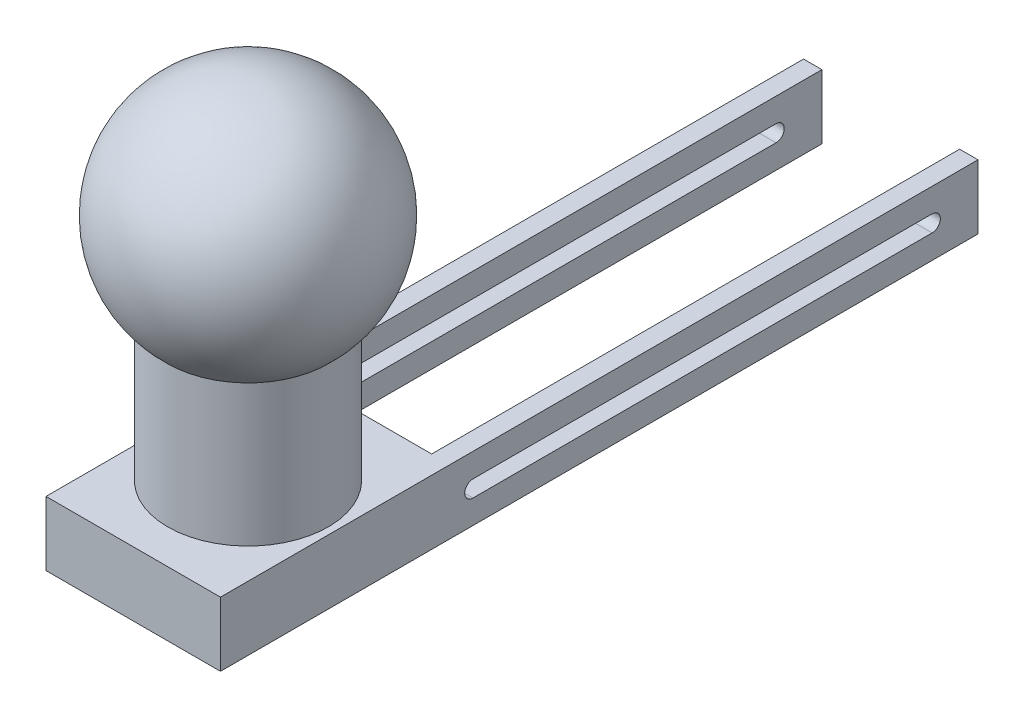
from build123d import *

# Parameters (mm, degrees)
BOSS_EXTRUDE1_DEPTH = 17.78
SKETCH3_R           = 22.225
BOSS_EXTRUDE2_DEPTH = 63.5
CUT_EXTRUDE1_DEPTH  = 185.154379258


with BuildPart() as part:
    # Sketch1 → Boss-Extrude1 (new body)
    with BuildSketch(Plane(origin=(0, 0, 0), x_dir=(1, 0, 0), z_dir=(0, 1, 0))):
        Polygon((-19.05, 146.05), (-24.13, 146.05), (-24.13, -63.5), (24.13, -63.5), (24.13, 146.05), (19.05, 146.05), (19.05, 0), (-19.05, 0), align=None)
    extrude(amount=-BOSS_EXTRUDE1_DEPTH)

    # Sketch3 → Boss-Extrude2 (add)
    with BuildSketch(Plane(origin=(0, 0, 0), x_dir=(1, 0, 0), z_dir=(0, 1, 0))):
        with Locations((0, -31.75)):
            Circle(SKETCH3_R)
    extrude(amount=BOSS_EXTRUDE2_DEPTH)

    # Sketch5 → Revolve1 (revolve)
    with BuildSketch(Plane(origin=(0, 0, 31.75), x_dir=(0, -1, 0), z_dir=(0, 0, 1))):
        with BuildLine():
            Line((-63.5, -33.02), (-63.5, 33.02))
            ThreePointArc((-63.5, 33.02), (-96.52, 0), (-63.5, -33.02))
        make_face()
    revolve(axis=Axis((0, 63.5, 31.75), (1, 0, 0)))

    # Sketch6 → Cut-Extrude1 (cut, through all)
    with BuildSketch(Plane.ZY.offset(24.13)):
        with BuildLine():
            Line((-133.35, -6.604), (-6.35, -6.604))
            ThreePointArc((-6.35, -6.604), (-4.064, -8.89), (-6.35, -11.176))
            Line((-6.35, -11.176), (-133.35, -11.176))
            ThreePointArc((-133.35, -11.176), (-135.636, -8.89), (-133.35, -6.604))
        make_face()
    extrude(amount=-CUT_EXTRUDE1_DEPTH, mode=Mode.SUBTRACT)


solid = part.part
